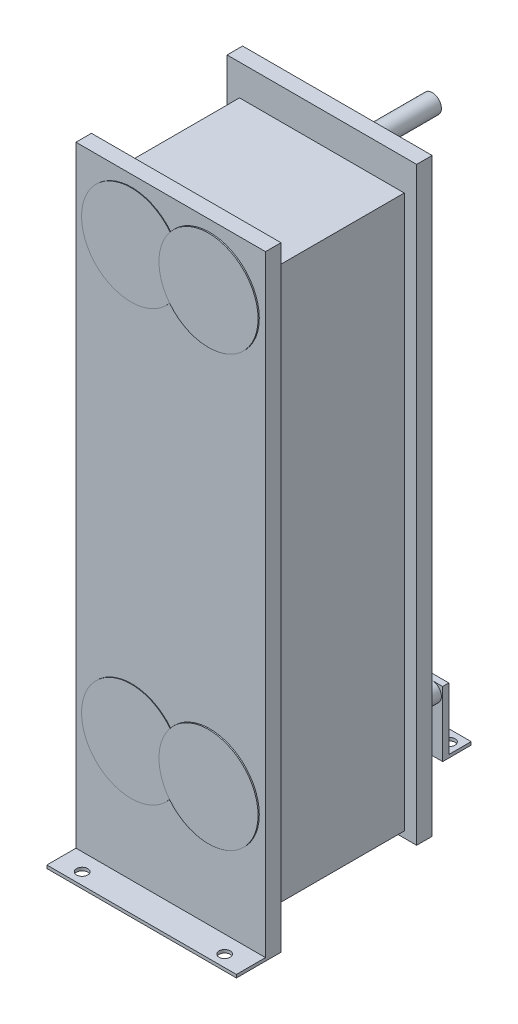
from build123d import *

# Parameters (mm, degrees)
SKETCH_1_W        = 306
SKETCH_1_H        = 992
EXTRUDE_1_DEPTH   = 25
SKETCH_3_W        = 306
SKETCH_3_H        = 952
EXTRUDE_2_DEPTH   = 25
SKETCH_15_W       = 266
SKETCH_15_H       = 892
EXTRUDE3_DEPTH    = 219
SKETCH3_W         = 306
SKETCH3_H         = 47
SKETCH3_R         = 9
SKETCH3_W_2       = 34
SKETCH3_H_2       = 36
EXTRUDE6_DEPTH    = 5
SKETCH4_W         = 34
SKETCH4_H         = 105
EXTRUDE7_DEPTH    = 10
SKETCH5_R         = 15
EXTRUDE8_DEPTH    = 153
SKETCH_17_R       = 28.5
EXTRUDE_1_2_DEPTH = 1
SKETCH_18_R       = 80
EXTRUDE_2_2_DEPTH = 20
SKETCH_19_R       = 28.5
EXTRUDE_3_DEPTH   = 1
SKETCH_20_R       = 80
EXTRUDE_4_DEPTH   = 20


with BuildPart() as part:
    # Эскиз1 → Extrude 1 (new body)
    with BuildSketch(Plane.XY):
        Rectangle(SKETCH_1_W, SKETCH_1_H)
    extrude(amount=EXTRUDE_1_DEPTH)



with BuildPart() as body_2:
    # Эскиз3 → Extrude 2 (new body)
    with BuildSketch(Plane(origin=(0, 0, -219), x_dir=(-1, 0, 0), z_dir=(0, 0, -1))):
        with Locations((0, 20)):
            Rectangle(SKETCH_3_W, SKETCH_3_H)
    extrude(amount=EXTRUDE_2_DEPTH)


with BuildPart() as part_1:
    add(part.part)

    add(body_2.part)  # Extrude3 merges body 2
    # Эскиз15 → Extrude3 (add)
    with BuildSketch(Plane(origin=(0, 0, 0), x_dir=(-1, 0, 0), z_dir=(0, 0, -1))):
        Rectangle(SKETCH_15_W, SKETCH_15_H)
    extrude(amount=EXTRUDE3_DEPTH)

    # Sketch3 → Extrude6 (add)
    # profile 1 of 2: a face of its own
    with BuildSketch(Plane.XZ.offset(496)):
        with Locations((0, 48.5)):
            Rectangle(SKETCH3_W, SKETCH3_H)
        with Locations(Location((-115, 53, 0), (0, 0, 270))):
            Circle(SKETCH3_R, mode=Mode.SUBTRACT)
        with Locations(Location((115, 53, 0), (0, 0, 270))):
            Circle(SKETCH3_R, mode=Mode.SUBTRACT)
    # profile 2 of 2: a face of its own
    with BuildSketch(Plane.XZ.offset(496)):
        with Locations((0, -425)):
            Rectangle(SKETCH3_W_2, SKETCH3_H_2)
        with Locations(Location((0, -425, 0), (0, 0, 270))):
            Circle(SKETCH3_R, mode=Mode.SUBTRACT)
    extrude(amount=-EXTRUDE6_DEPTH)


with BuildPart() as extrude6_piece_1:
    # of the separate pieces the step leaves, piece 1, a body of its own (extrude6_pieces)
    add(part_1.part.solids().sort_by_distance((153, 496, -219))[0])



with BuildPart() as extrude6_piece_2:
    # of the separate pieces the step leaves, piece 2, a body of its own (extrude6_pieces)
    add(part_1.part.solids().sort_by_distance((-17, -496, -443))[0])

    # Sketch4 → Extrude7 (add)
    with BuildSketch(Plane.XY.offset(-407)):
        with Locations((0, -443.5)):
            Rectangle(SKETCH4_W, SKETCH4_H)
    extrude(amount=EXTRUDE7_DEPTH)


with BuildPart() as extrude6_piece_1_1:
    add(extrude6_piece_1.part)

    add(extrude6_piece_2.part)  # Extrude8 merges Extrude6 piece 2
    # Sketch5 → Extrude8 (add)
    with BuildSketch(Plane(origin=(0, 0, -244), x_dir=(-1, 0, 0), z_dir=(0, 0, -1))):
        with Locations(Location((0, -406, 0), (0, 0, 90))):
            Circle(SKETCH5_R)
        with Locations((0, 416)):
            Circle(SKETCH5_R)
    extrude(amount=EXTRUDE8_DEPTH)

    # Эскиз17 → Extrude 1 2 (add)
    with BuildSketch(Plane.XY.offset(25)):
        with Locations((-63, -296)):
            Circle(SKETCH_17_R)
        with Locations((63, -296)):
            Circle(SKETCH_17_R)
        with Locations((-63, 398)):
            Circle(SKETCH_17_R)
        with Locations((63, 398)):
            Circle(SKETCH_17_R)
    extrude(amount=EXTRUDE_1_2_DEPTH)

    # Эскиз18 → Extrude 2 2 (add)
    with BuildSketch(Plane.XY.offset(26)):
        with Locations((-63, 398)):
            Circle(SKETCH_18_R)
        with Locations((-63, -296)):
            Circle(SKETCH_18_R)
    extrude(amount=-EXTRUDE_2_2_DEPTH)

    # Эскиз19 → Бобышка-Вытянуть3 (add)
    with BuildSketch(Plane.XY.offset(26)):
        with Locations((63, 398)):
            Circle(SKETCH_19_R)
        with Locations((63, -296)):
            Circle(SKETCH_19_R)
    extrude(amount=EXTRUDE_3_DEPTH)

    # Эскиз20 → Бобышка-Вытянуть4 (add)
    with BuildSketch(Plane.XY.offset(27)):
        with Locations((63, 398)):
            Circle(SKETCH_20_R)
        with Locations((63, -296)):
            Circle(SKETCH_20_R)
    extrude(amount=-EXTRUDE_4_DEPTH)


solid = extrude6_piece_1_1.part
